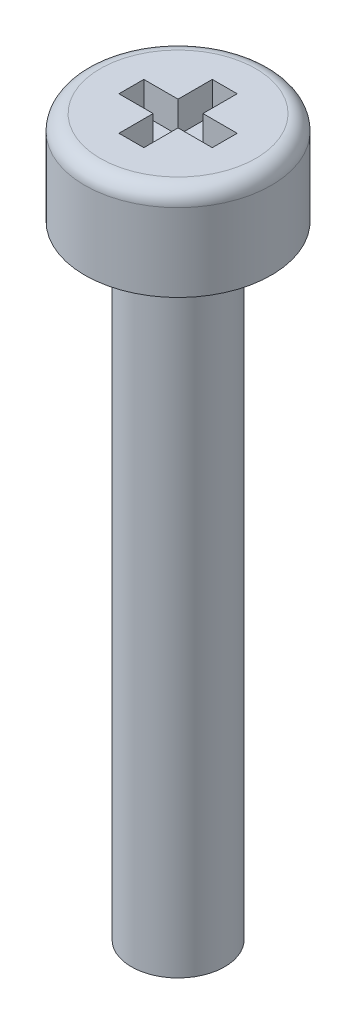
from build123d import *

# Parameters (mm, degrees)
SKETCH1_R           = 3
BOSS_EXTRUDE1_DEPTH = 3
SKETCH2_R           = 1.5
BOSS_EXTRUDE2_DEPTH = 20
FILLET1_R           = 0.5
SKETCH3_W           = 0.8
SKETCH3_H           = 1.1
SKETCH3_W_2         = 1.1
SKETCH3_H_2         = 0.8
CUT_EXTRUDE1_DEPTH  = 1


with BuildPart() as part:
    # Sketch1 → Boss-Extrude1 (new body)
    with BuildSketch(Plane(origin=(0, 0, 0), x_dir=(1, 0, 0), z_dir=(0, 1, 0))):
        with Locations(Location((0, 0, 0), (0, 0, 270))):
            Circle(SKETCH1_R)
    extrude(amount=BOSS_EXTRUDE1_DEPTH)

    # Sketch2 → Boss-Extrude2 (add)
    with BuildSketch(Plane.XZ):
        with Locations(Location((0, 0, 0), (0, 0, 270))):
            Circle(SKETCH2_R)
    extrude(amount=BOSS_EXTRUDE2_DEPTH)

    # Fillet1
    fillet1_edges = [part.edges().sort_by_distance(p)[0] for p in [
        (0, 3, -3),
    ]]
    fillet(fillet1_edges, radius=FILLET1_R)

    # Sketch3 → Cut-Extrude1 (cut)
    with BuildSketch(Plane(origin=(0, 3, 0), x_dir=(1, 0, 0), z_dir=(0, 1, 0))):
        with Locations((0, 0.95)):
            Rectangle(SKETCH3_W, SKETCH3_H)
        with Locations((0.95, 0)):
            Rectangle(SKETCH3_W_2, SKETCH3_H_2)
        with Locations((0, -0.95)):
            Rectangle(SKETCH3_W, SKETCH3_H)
        with Locations((-0.95, 0)):
            Rectangle(SKETCH3_W_2, SKETCH3_H_2)
        Rectangle(SKETCH3_W, SKETCH3_H_2)
    extrude(amount=-CUT_EXTRUDE1_DEPTH, mode=Mode.SUBTRACT)


solid = part.part
